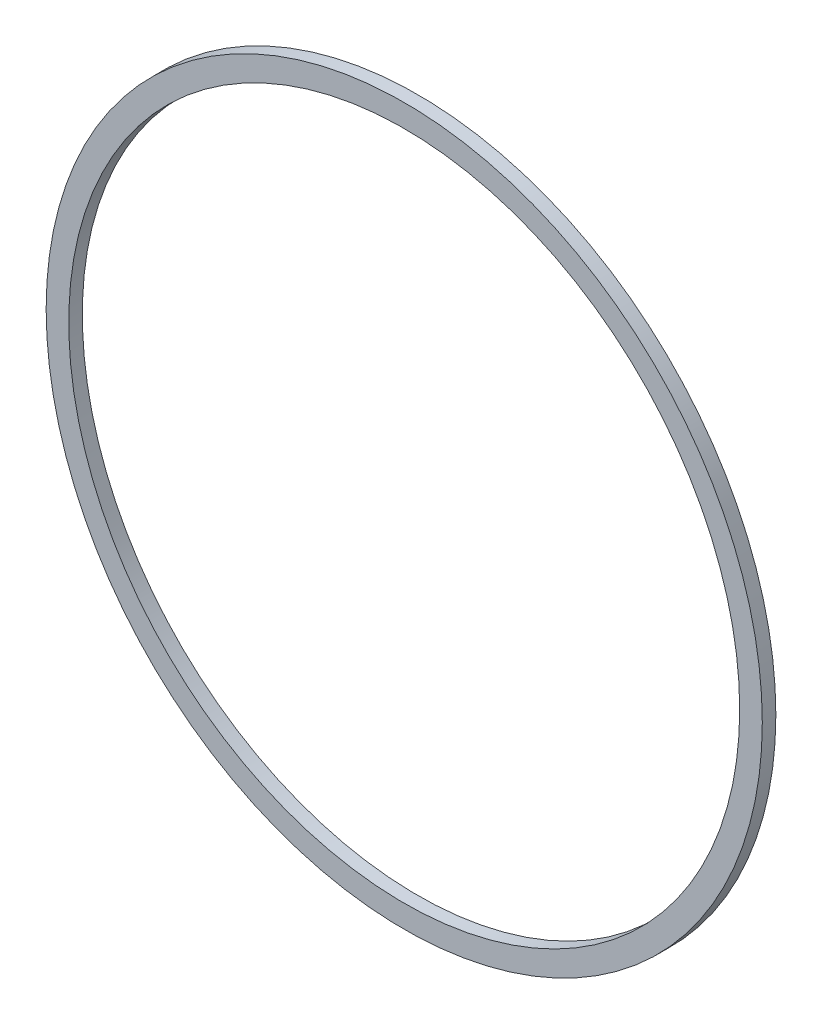
from build123d import *

# Parameters (mm, degrees)
IZIM1_R                     = 15.85
IZIM1_R_2                   = 14.85
Y_KSEKLIK_EKSTR_ZYON1_DEPTH = 0.6


with BuildPart() as part:
    # Çizim1 → Yükseklik-Ekstrüzyon1 (new body)
    with BuildSketch(Plane.XY):
        Circle(IZIM1_R)
        Circle(IZIM1_R_2, mode=Mode.SUBTRACT)
    extrude(amount=Y_KSEKLIK_EKSTR_ZYON1_DEPTH)


solid = part.part
